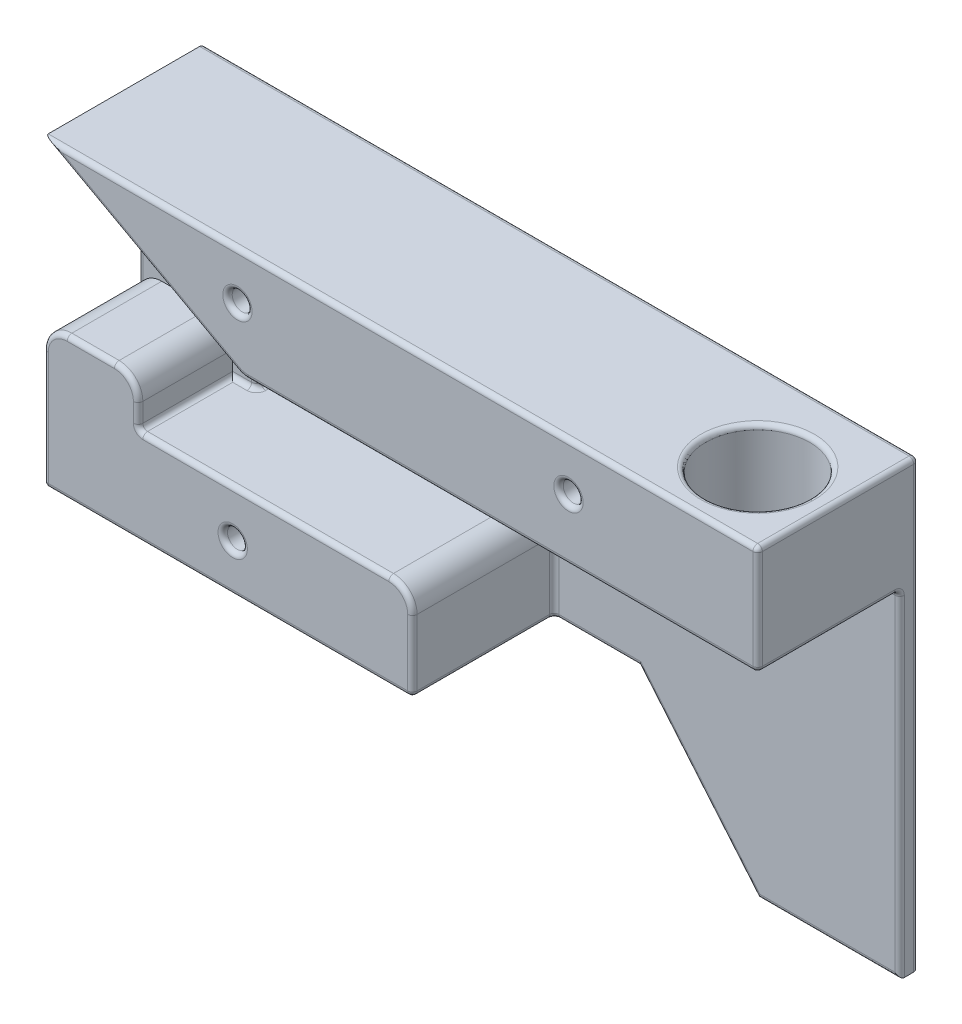
from build123d import *

# Parameters (mm, degrees)
BOSS_EXTRUDE1_DEPTH   = 4
BOSS_EXTRUDE2_DEPTH   = 30
BOSS_EXTRUDE3_DEPTH   = 10
BOSS_EXTRUDE4_DEPTH   = 5
FILLET1_R             = 5
CUT_EXTRUDE1_REACH    = 183.088
SKETCH5_R             = 11
M5_TAPPED_HOLE1_D     = 4.2
M5_TAPPED_HOLE1_DEPTH = 12.4
M5_TAPPED_HOLE1_TIP   = 1.2618073
FILLET3_R             = 1


with BuildPart() as part:
    # Sketch1 → Boss-Extrude1 (new body)
    with BuildSketch(Plane.XY):
        Polygon((95.827011065, 0), (121, -30), (151, -30), (151, 64), (0, 64), (0, 0), align=None)
    extrude(amount=BOSS_EXTRUDE1_DEPTH)

    # Sketch2 → Boss-Extrude2 (add)
    with BuildSketch(Plane.XY.offset(4)):
        Polygon((0, 64), (151, 64), (151, 41), (42, 41), align=None)
        Polygon((20, 20), (20, 30), (0, 30), (0, 0), (78, 0), (78, 20), align=None)
    extrude(amount=BOSS_EXTRUDE2_DEPTH)

    # Sketch3 → Boss-Extrude3 (add)
    with BuildSketch(Plane.XY.offset(4)):
        Polygon((25, 20), (25, 50.30952381), (0, 64), (0, 30), (20, 30), (20, 20), align=None)
    extrude(amount=BOSS_EXTRUDE3_DEPTH)

    # Sketch4 → Boss-Extrude4 (add)
    with BuildSketch(Plane.XY.offset(4)):
        Polygon((25, 50.30952381), (42, 41), (69, 41), (69, 20), (25, 20), align=None)
    extrude(amount=BOSS_EXTRUDE4_DEPTH)

    # Fillet1
    fillet1_edges = [part.edges().sort_by_distance(p)[0] for p in [
        (42, 41, 21.5),
        (78, 20, 19),
        (20, 30, 24),
        (0, 30, 24),
    ]]
    fillet(fillet1_edges, radius=FILLET1_R)

    # Sketch5 → Cut-Extrude1 (cut, up to next)
    with BuildSketch(Plane(origin=(0, 64, 0), x_dir=(1, 0, 0), z_dir=(0, 1, 0)), mode=Mode.PRIVATE) as cut_extrude1_sk1:
        with Locations(Location((136, -19, 0), (0, 0, 270))):
            Circle(SKETCH5_R)
    cut_extrude1_tool1 = extrude(cut_extrude1_sk1.sketch, amount=-CUT_EXTRUDE1_REACH, mode=Mode.PRIVATE) & part.part
    add(cut_extrude1_tool1.solids().sort_by_distance((136, 64, 19))[0], mode=Mode.SUBTRACT)

    # M5 Tapped Hole1
    with Locations(Plane.XY.offset(34)):
        with Locations((41, 54), (111, 54), (40, 10)):
            Hole(M5_TAPPED_HOLE1_D / 2, depth=M5_TAPPED_HOLE1_DEPTH)
            with Locations((0, 0, -(M5_TAPPED_HOLE1_DEPTH + M5_TAPPED_HOLE1_TIP / 2))):  # 118° drill point
                Cone(0, M5_TAPPED_HOLE1_D / 2, M5_TAPPED_HOLE1_TIP, mode=Mode.SUBTRACT)

    # Fillet3
    fillet3_edges = [part.edges().sort_by_distance(p)[0] for p in [
        (151, 64, 17),
        (0, 0, 17),
        (136, 64, 8),
        (136, 41, 8),
        (42.1, 10, 34),
        (113.1, 54, 34),
        (108.413505532, -15, 4),
        (43.1, 54, 34),
        (136, -30, 4),
        (151, 5.5, 4),
        (151, 41, 19),
        (20.438917744, 52.80725933, 34),
        (151, 52.5, 34),
        (75.5, 64, 34),
        (86.913505532, 0, 4),
        (20, 20, 24),
        (78, 7.5, 4),
        (78, 0, 19),
        (20, 22.5, 34),
        (39, 0, 34),
        (78, 7.5, 34),
        (25, 20, 11.5),
        (22.5, 20, 14),
        (25, 35.154761905, 14),
        (0, 44.5, 14),
        (75.5, 64, 0),
        (110, 41, 4),
        (151, 17, 0),
        (69, 30.5, 4),
        (69, 20, 6.5),
        (69, 41, 6.5),
        (136, -30, 0),
        (25, 35.154761905, 9),
        (47, 20, 9),
        (69, 30.5, 9),
        (56.139704302, 41, 9),
        (108.413505532, -15, 0),
        (47.913505532, 0, 0),
        (46.5, 20, 34),
        (71, 20, 4),
        (0, 32, 0),
        (10, 30, 34),
        (0, 12.5, 34),
        (18.535533906, 28.535533906, 34),
        (1.464466094, 28.535533906, 34),
        (76.535533906, 18.535533906, 34),
        (97.139704302, 41, 34),
        (32.938917744, 45.962021235, 9),
        (42.039934258, 41.156065303, 34),
        (76.535533906, 18.535533906, 4),
        (42.039934258, 41.156065303, 9),
    ]]
    fillet(fillet3_edges, radius=FILLET3_R)


solid = part.part
